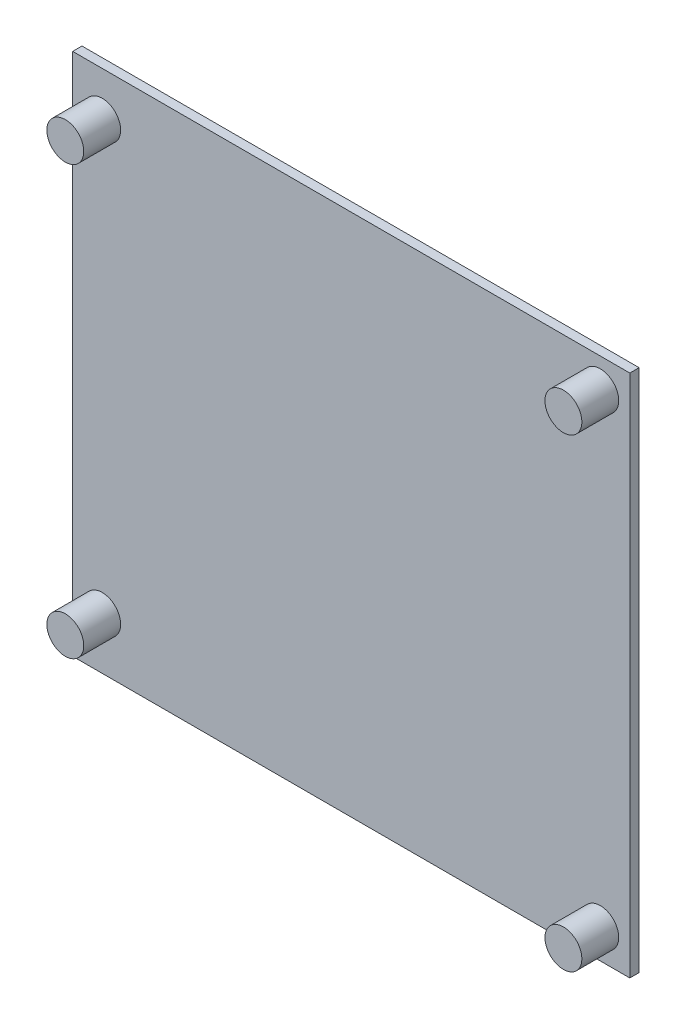
from build123d import *

# Parameters (mm, degrees)
SKETCH1_W                = 95.885
SKETCH1_H                = 90.17
SKETCH1_R                = 3.175
BOSS_EXTRUDE1_DEPTH      = 1.6
BOSS_EXTRUDE2_DEPTH      = 7.95
BOSS_EXTRUDE2_DEPTH_BACK = 0.4
SKETCH1_3_R              = 3.175


with BuildPart() as part:
    # Sketch1 → Boss-Extrude1 (new body)
    with BuildSketch(Plane.XY):
        Rectangle(SKETCH1_W, SKETCH1_H)
        with Locations((42.8625, -40.005)):
            Circle(SKETCH1_R, mode=Mode.SUBTRACT)
        with Locations((-42.8625, -36.195)):
            Circle(SKETCH1_R, mode=Mode.SUBTRACT)
        with Locations((-42.8625, 37.465)):
            Circle(SKETCH1_R, mode=Mode.SUBTRACT)
        with Locations((42.8625, 40.005)):
            Circle(SKETCH1_R, mode=Mode.SUBTRACT)
    extrude(amount=BOSS_EXTRUDE1_DEPTH)

    # Sketch1<3> → Boss-Extrude2 (add, two sides: drawn at the far end of the back side and taken through both)
    with BuildSketch(Plane.XY.offset(-BOSS_EXTRUDE2_DEPTH_BACK)):
        with Locations((42.8625, -40.005)):
            Circle(SKETCH1_3_R)
        with Locations((-42.8625, -36.195)):
            Circle(SKETCH1_3_R)
        with Locations((-42.8625, 37.465)):
            Circle(SKETCH1_3_R)
        with Locations((42.8625, 40.005)):
            Circle(SKETCH1_3_R)
    extrude(amount=BOSS_EXTRUDE2_DEPTH + BOSS_EXTRUDE2_DEPTH_BACK)


solid = part.part
